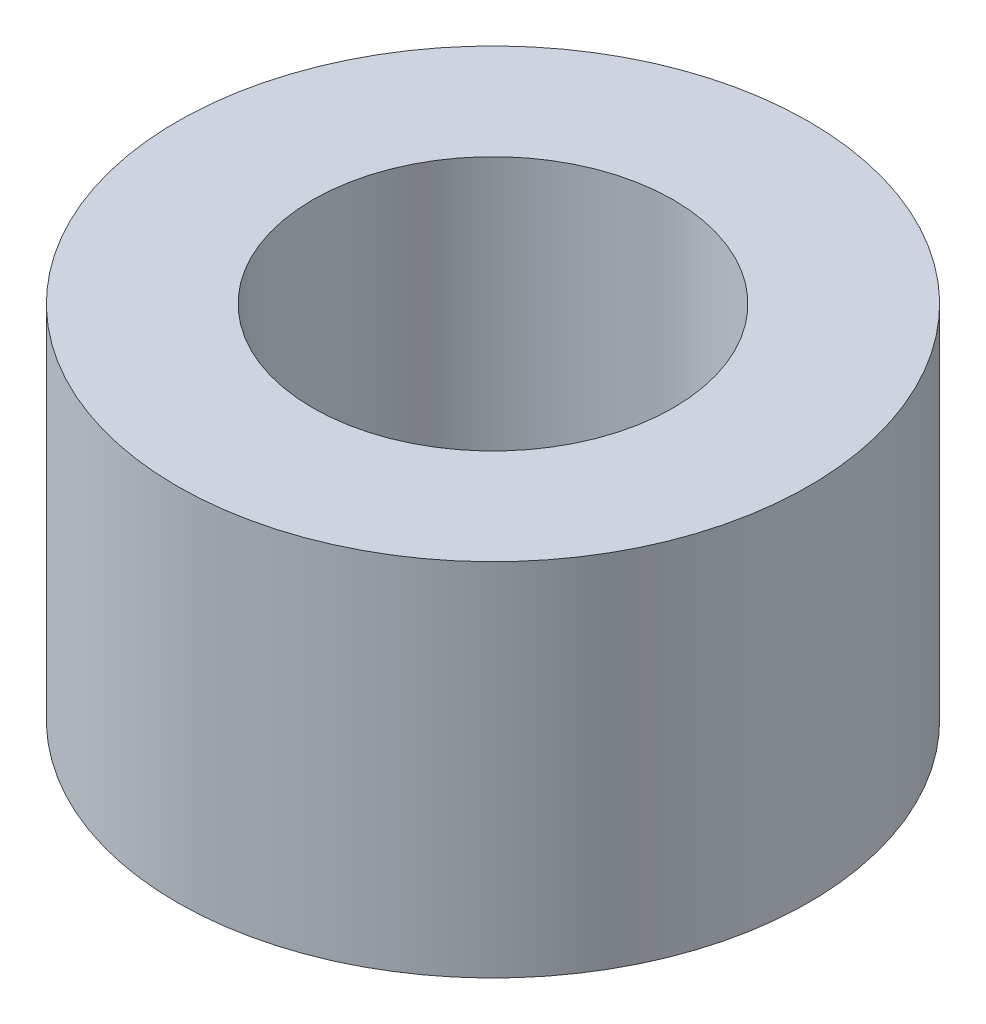
from build123d import *

# Parameters (mm, degrees)
SKETCH1_R           = 5.5626
BOSS_EXTRUDE1_DEPTH = 6.35
SKETCH2_R           = 3.175
CUT_EXTRUDE1_DEPTH  = 6.35


with BuildPart() as part:
    # Sketch1 → Boss-Extrude1 (new body)
    with BuildSketch(Plane(origin=(0, 0, 0), x_dir=(1, 0, 0), z_dir=(0, 1, 0))):
        with Locations(Location((0, 0, 0), (0, 0, 270))):
            Circle(SKETCH1_R)
    extrude(amount=BOSS_EXTRUDE1_DEPTH)

    # Sketch2 → Cut-Extrude1 (cut)
    with BuildSketch(Plane.XZ):
        with Locations(Location((0, 0, 0), (0, 0, 270))):
            Circle(SKETCH2_R)
    extrude(amount=-CUT_EXTRUDE1_DEPTH, mode=Mode.SUBTRACT)


solid = part.part
